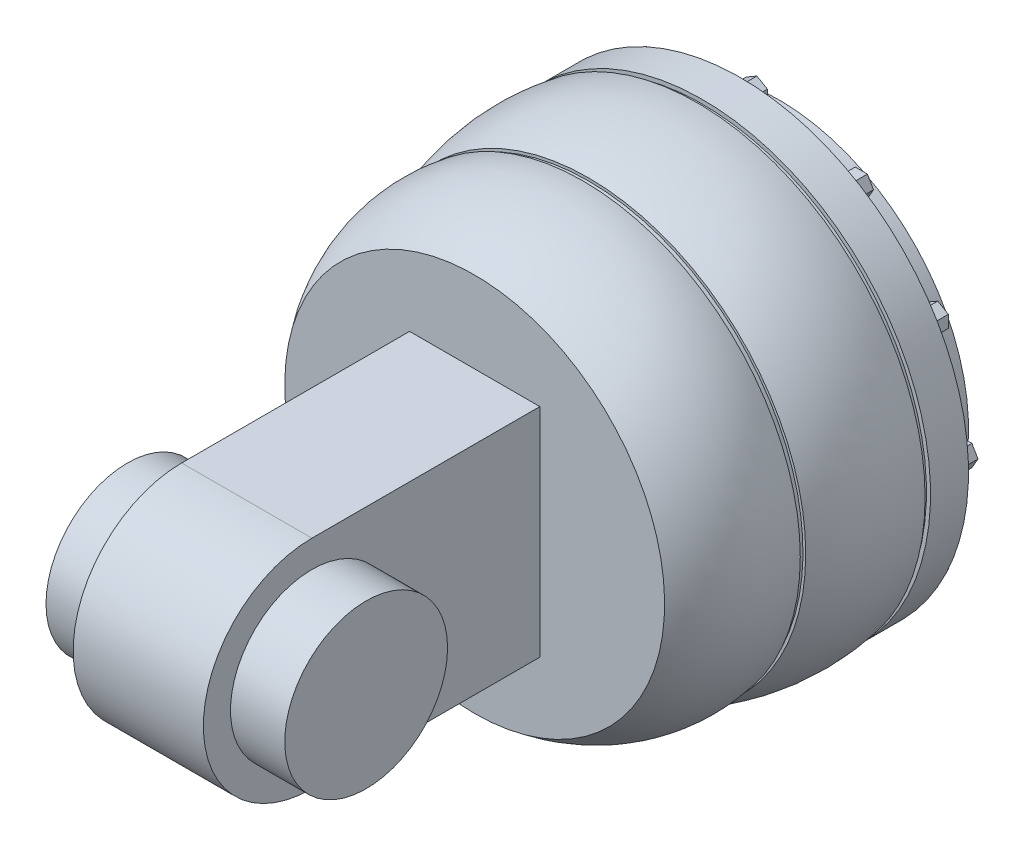
from build123d import *

# Parameters (mm, degrees)
SKETCH2_R            = 39.5
BOSS_EXTRUDE1_DEPTH  = 1
SKETCH4_R            = 41.25
BOSS_EXTRUDE2_DEPTH  = 1
SKETCH5_R            = 42
BOSS_EXTRUDE3_DEPTH  = 7
SKETCH6_R            = 35
BOSS_EXTRUDE4_DEPTH  = 7
BOSS_EXTRUDE5_DEPTH  = 3
CIRPATTERN1_COUNT    = 12
SKETCH8_R            = 15
BOSS_EXTRUDE6_DEPTH  = 10
SKETCH9_W            = 24
SKETCH9_H            = 40
BOSS_EXTRUDE7_DEPTH  = 42
BOSS_EXTRUDE8_DEPTH  = 24
SKETCH11_R           = 15
BOSS_EXTRUDE9_DEPTH  = 10
BOSS_EXTRUDE10_START = 10
SKETCH12_R           = 15
BOSS_EXTRUDE10_DEPTH = 10


with BuildPart() as part:
    # Sketch1 → Revolve1 (revolve)
    with BuildSketch(Plane.YZ):
        with BuildLine():
            Line((-35, 0), (0, 0))
            Line((0, 0), (0, -20))
            Line((0, -20), (-40, -20))
            ThreePointArc((-40, -20), (-39.657515479, -9.46062113), (-35, 0))
        make_face()
    revolve(axis=Axis((0, 0, 0), (0, 0, -1)))

    # Sketch2 → Boss-Extrude1 (add)
    with BuildSketch(Plane(origin=(0, 0, -20), x_dir=(1, 0, 0), z_dir=(0, 0, -1))):
        with Locations(Location((0, 0, 0), (0, 0, 270))):
            Circle(SKETCH2_R)
    extrude(amount=BOSS_EXTRUDE1_DEPTH)

    # Sketch3 → Revolve2 (revolve)
    with BuildSketch(Plane(origin=(0, 0, 0), x_dir=(-1, 0, 0), z_dir=(0, 1, 0)), mode=Mode.PRIVATE) as revolve2_sk:
        with BuildLine():
            Line((0, -21), (0, -41))
            Line((0, -41), (-42, -41))
            ThreePointArc((-42, -41), (-42.384109041, -30.861589096), (-40, -21))
            Line((-40, -21), (0, -21))
        make_face()
    revolve(revolve2_sk.sketch.rotate(Axis((0, 0, -21), (0, 0, -1)), 90), axis=Axis((0, 0, -21), (0, 0, -1)))

    # Sketch4 → Boss-Extrude2 (add)
    with BuildSketch(Plane(origin=(0, 0, -41), x_dir=(1, 0, 0), z_dir=(0, 0, -1))):
        with Locations(Location((0, 0, 0), (0, 0, 180))):
            Circle(SKETCH4_R)
    extrude(amount=BOSS_EXTRUDE2_DEPTH)

    # Sketch5 → Boss-Extrude3 (add)
    with BuildSketch(Plane(origin=(0, 0, -42), x_dir=(1, 0, 0), z_dir=(0, 0, -1))):
        with Locations(Location((0, 0, 0), (0, 0, 180))):
            Circle(SKETCH5_R)
    extrude(amount=BOSS_EXTRUDE3_DEPTH)

    # Sketch6 → Boss-Extrude4 (add)
    with BuildSketch(Plane(origin=(0, 0, -49), x_dir=(1, 0, 0), z_dir=(0, 0, -1))):
        with Locations(Location((0, 0, 0), (0, 0, 180))):
            Circle(SKETCH6_R)
    extrude(amount=BOSS_EXTRUDE4_DEPTH)

    # Sketch7 → Boss-Extrude5 (add)
    with BuildSketch(Plane(origin=(0, 0, -49), x_dir=(1, 0, 0), z_dir=(0, 0, -1))):
        Polygon((40.75, 0), (39.625, 1.948557159), (37.375, 1.948557159), (36.25, 0), (37.375, -1.948557159), (39.625, -1.948557159), align=None)
        Polygon((39.047649731, 0.948557159), (37.952350269, 0.948557159), (37.404700538, 0), (37.952350269, -0.948557159), (39.047649731, -0.948557159), (39.595299462, 0), align=None, mode=Mode.SUBTRACT)
    boss_extrude5 = extrude(amount=BOSS_EXTRUDE5_DEPTH)

    # CirPattern1: Boss-Extrude5 ×12 about axis
    cirpattern1_axis = Axis((0, 0, 0), (0, 0, 1))
    for i in range(1, CIRPATTERN1_COUNT):
        add(boss_extrude5.rotate(cirpattern1_axis, i * 360 / CIRPATTERN1_COUNT))

    # Sketch8 → Boss-Extrude6 (add)
    with BuildSketch(Plane(origin=(0, 0, -56), x_dir=(1, 0, 0), z_dir=(0, 0, -1))):
        with Locations(Location((0, 0, 0), (0, 0, 180))):
            Circle(SKETCH8_R)
    extrude(amount=BOSS_EXTRUDE6_DEPTH)

    # Sketch9 → Boss-Extrude7 (add)
    with BuildSketch(Plane.XY):
        Rectangle(SKETCH9_W, SKETCH9_H)
    extrude(amount=BOSS_EXTRUDE7_DEPTH)



with BuildPart() as body_2:
    # Sketch10 → Boss-Extrude8 (new body)
    with BuildSketch(Plane.YZ.offset(12)):
        with BuildLine():
            Line((-20, 42), (20, 42))
            ThreePointArc((20, 42), (0, 62), (-20, 42))
        make_face()
    extrude(amount=-BOSS_EXTRUDE8_DEPTH)


with BuildPart() as part_1:
    add(part.part)

    add(body_2.part)  # Boss-Extrude9 merges body 2
    # Sketch11 → Boss-Extrude9 (add)
    with BuildSketch(Plane.YZ.offset(12)):
        with Locations(Location((0, 42, 0), (0, 0, 270))):
            Circle(SKETCH11_R)
    extrude(amount=BOSS_EXTRUDE9_DEPTH)

    # Sketch12 → Boss-Extrude10 (add)
    with BuildSketch(Plane(origin=(-12, 0, 0), x_dir=(0, -1, 0), z_dir=(-1, 0, 0)).offset(BOSS_EXTRUDE10_START)):
        with Locations(Location((0, 42, 0), (0, 0, 270))):
            Circle(SKETCH12_R)
    extrude(amount=-BOSS_EXTRUDE10_DEPTH)


solid = part_1.part
